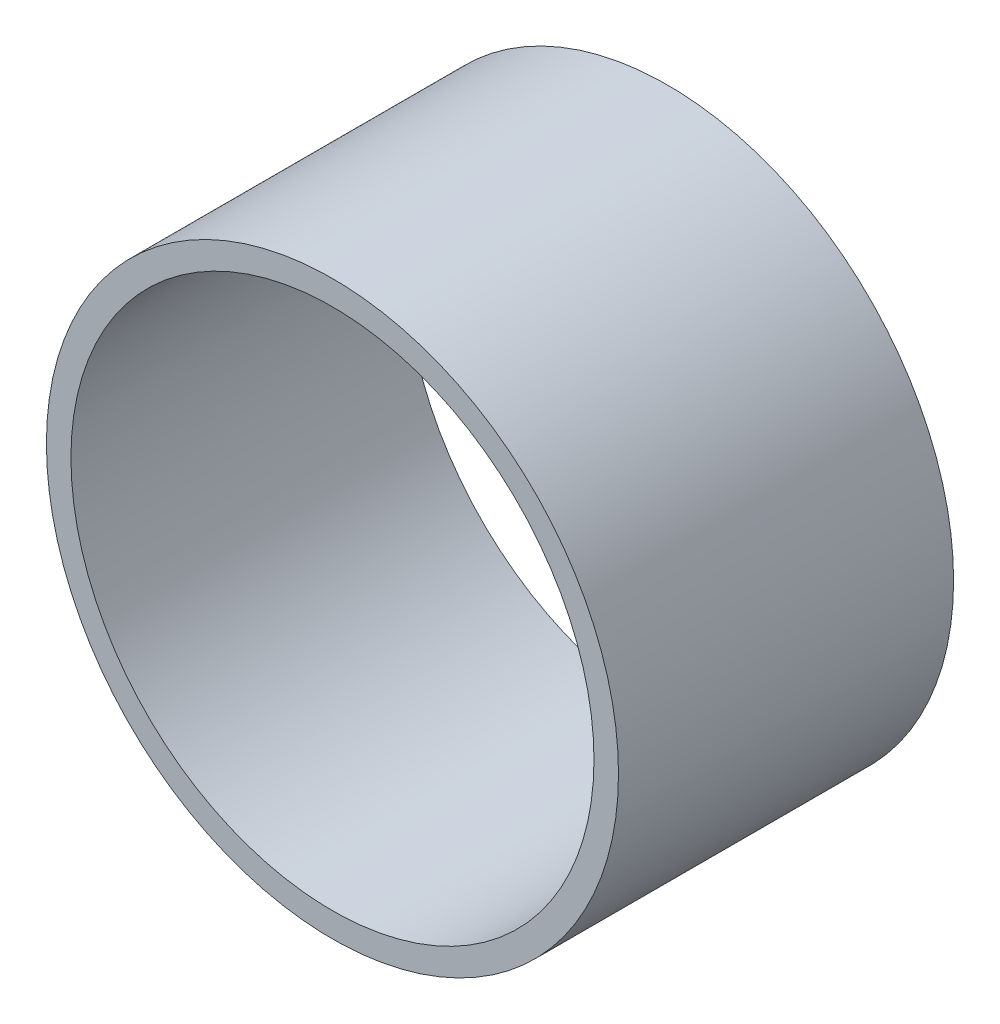
from build123d import *

# Parameters (mm, degrees)
BOSS_EXTRUDE1_DEPTH      = 20.5
BOSS_EXTRUDE1_DEPTH_BACK = 20.5
SKETCH1_R                = 35
SKETCH1_R_2              = 32


with BuildPart() as part:
    # Sketch1 → Boss-Extrude1 (new, two sides: drawn at the far end of the back side and taken through both)
    with BuildSketch(Plane.XY.offset(-BOSS_EXTRUDE1_DEPTH_BACK)):
        Circle(SKETCH1_R)
        Circle(SKETCH1_R_2, mode=Mode.SUBTRACT)
    extrude(amount=BOSS_EXTRUDE1_DEPTH + BOSS_EXTRUDE1_DEPTH_BACK)


solid = part.part
